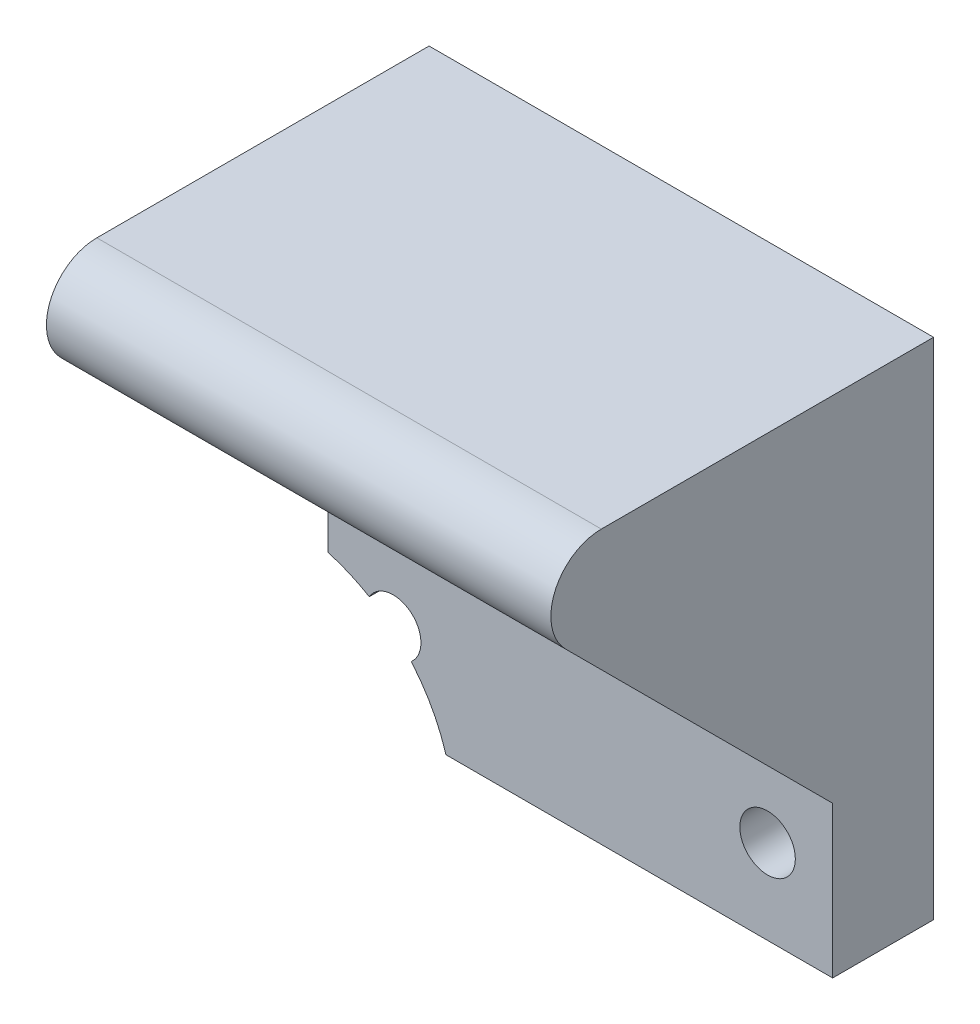
from build123d import *

# Parameters (mm, degrees)
BOSS_EXTRUDE1_DEPTH = 50
SKETCH3_R           = 17
CUT_EXTRUDE1_DEPTH  = 10
SKETCH4_R           = 2.75
CUT_EXTRUDE2_DEPTH  = 30
FILLET1_R           = 5


with BuildPart() as part:
    # Sketch2 → Boss-Extrude1 (new body)
    with BuildSketch(Plane(origin=(0, 0, 0), x_dir=(0, 0, -1), z_dir=(1, 0, 0))):
        Polygon((0, 0), (0, 50), (-45, 50), (-10, 15), (-10, 0), align=None)
    extrude(amount=BOSS_EXTRUDE1_DEPTH)

    # Sketch3 → Cut-Extrude1 (cut)
    with BuildSketch(Plane.XY.offset(10)):
        with Locations((-4.626643485, -4.843430201)):
            Circle(SKETCH3_R)
    extrude(amount=-CUT_EXTRUDE1_DEPTH, mode=Mode.SUBTRACT)

    # Sketch4 → Cut-Extrude2 (cut)
    with BuildSketch(Plane.XY.offset(10)):
        with Locations((6.441325863, 8.36656836)):
            Circle(SKETCH4_R)
        with Locations((43.550213874, 8.36656836)):
            Circle(SKETCH4_R)
    extrude(amount=-CUT_EXTRUDE2_DEPTH, mode=Mode.SUBTRACT)

    # Fillet1
    fillet1_edges = [part.edges().sort_by_distance(p)[0] for p in [
        (25, 50, 45),
    ]]
    fillet(fillet1_edges, radius=FILLET1_R)


solid = part.part
